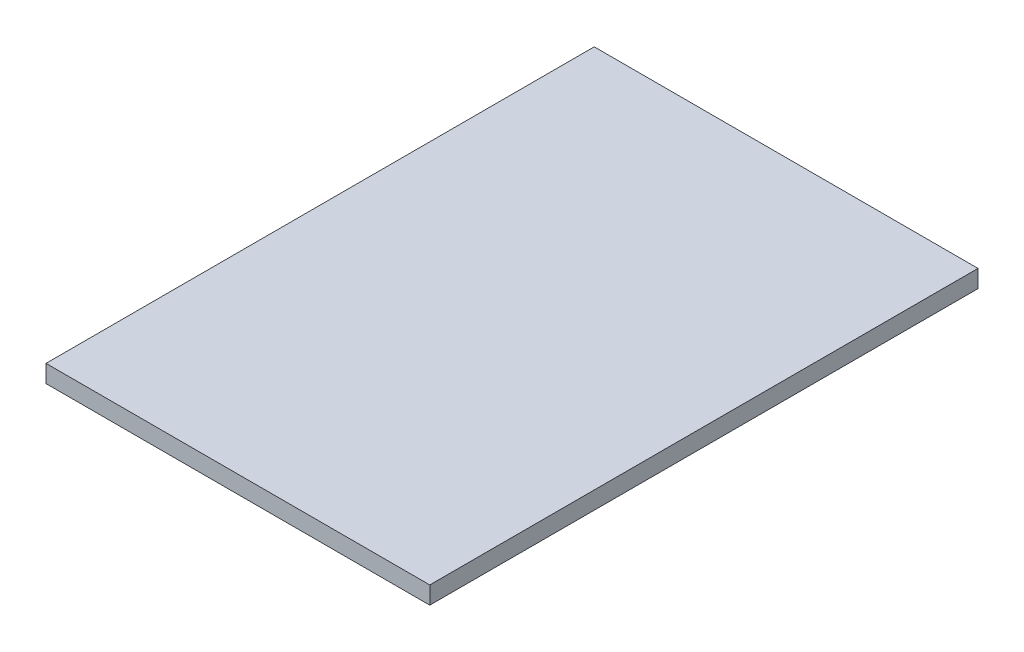
from build123d import *

# Parameters (mm, degrees)
SKETCH1_W           = 35
SKETCH1_H           = 50
BOSS_EXTRUDE1_DEPTH = 1.6


with BuildPart() as part:
    # Sketch1 → Boss-Extrude1 (new body)
    with BuildSketch(Plane(origin=(0, 0, 0), x_dir=(1, 0, 0), z_dir=(0, 1, 0))):
        Rectangle(SKETCH1_W, SKETCH1_H)
    extrude(amount=BOSS_EXTRUDE1_DEPTH)


solid = part.part
